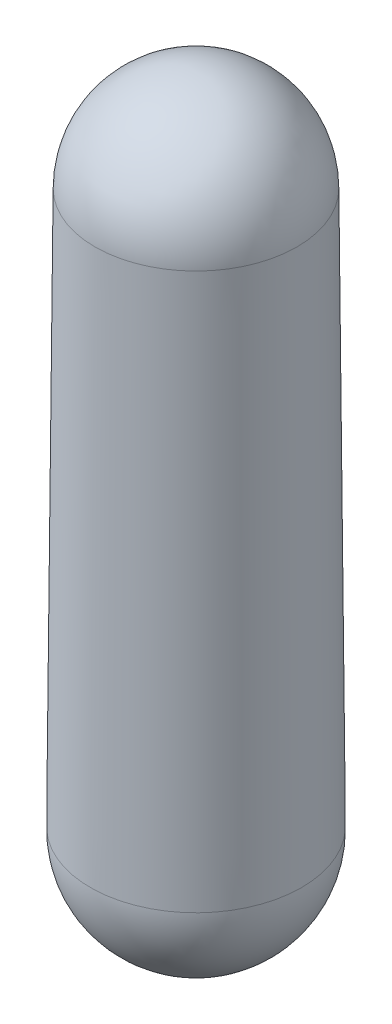
from build123d import *


with BuildPart() as part:
    # Sketch1 → Diafisis (revolve)
    with BuildSketch(Plane.XY, mode=Mode.PRIVATE) as diafisis_sk:
        Polygon((0, 0), (6.5, 0), (6.8, -35.662871488), (0, -35.662871488), align=None)
    revolve(diafisis_sk.sketch.rotate(Axis((0, -39.662871488, 0), (0, 1, 0)), 90), axis=Axis((0, -39.662871488, 0), (0, 1, 0)))

    # Sketch2 → Union_proximal (revolve)
    with BuildSketch(Plane.XY):
        with BuildLine():
            Line((0, -6.5), (0, 6.5))
            ThreePointArc((0, 6.5), (6.5, 0), (0, -6.5))
        make_face()
    revolve(axis=Axis((0, -10.5, 0), (0, 1, 0)))

    # Sketch3 → Union_distal (revolve)
    with BuildSketch(Plane.XY):
        with BuildLine():
            Line((0, -42.462871488), (0, -28.862871488))
            ThreePointArc((0, -28.862871488), (6.8, -35.662871488), (0, -42.462871488))
        make_face()
    revolve(axis=Axis((0, -46.462871488, 0), (0, 1, 0)))


solid = part.part
